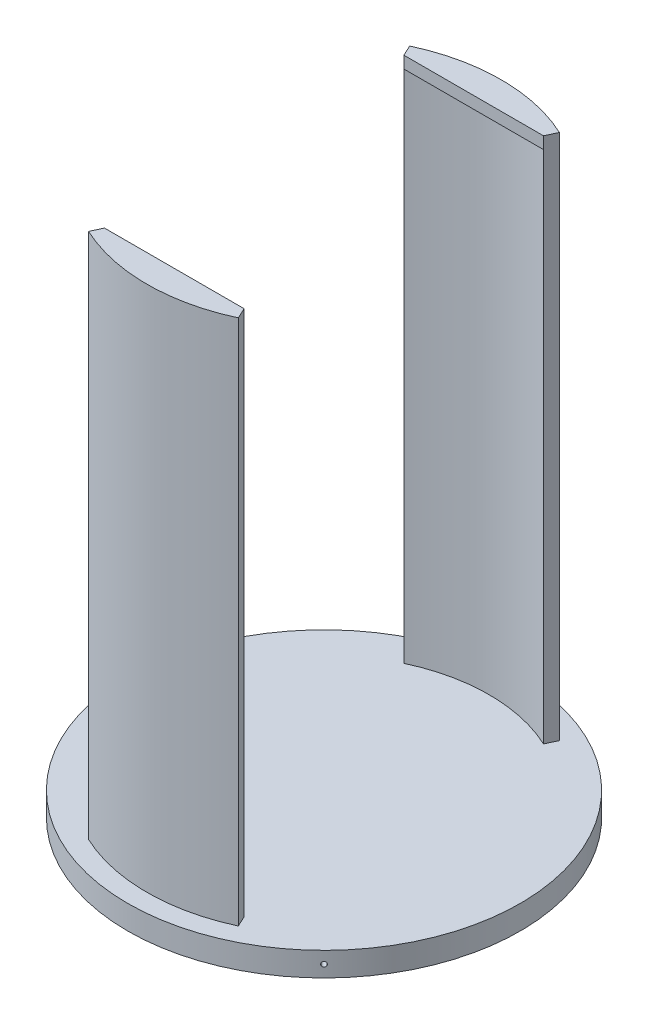
from build123d import *

# Parameters (mm, degrees)
SKETCH1_R           = 82
BOSS_EXTRUDE1_DEPTH = 10
BOSS_EXTRUDE4_DEPTH = 220
BOSS_EXTRUDE5_START = -5
BOSS_EXTRUDE5_DEPTH = 5
SKETCH7_R           = 1
CUT_EXTRUDE1_DEPTH  = 12
CIRPATTERN1_COUNT   = 4


with BuildPart() as part:
    # Sketch1 → Boss-Extrude1 (new body)
    with BuildSketch(Plane(origin=(0, 0, 0), x_dir=(1, 0, 0), z_dir=(0, 1, 0))):
        with Locations(Location((0, 0, 0), (0, 0, 270))):
            Circle(SKETCH1_R)
    extrude(amount=BOSS_EXTRUDE1_DEPTH)

    # Sketch2 → Boss-Extrude4 (add)
    with BuildSketch(Plane(origin=(0, 10, 0), x_dir=(1, 0, 0), z_dir=(0, 1, 0))):
        with BuildLine():
            Line((-29.16066006, 62.535237306), (-31.273751369, 67.066776241))
            ThreePointArc((-31.273751369, 67.066776241), (0, 74), (31.273751369, 67.066776241))
            Line((31.273751369, 67.066776241), (29.16066006, 62.535237306))
            ThreePointArc((29.16066006, 62.535237306), (0, 69), (-29.16066006, 62.535237306))
        make_face()
    boss_extrude4 = extrude(amount=BOSS_EXTRUDE4_DEPTH)

    # Mirror2: Boss-Extrude4 across plane
    add(boss_extrude4.mirror(Plane.XY))

    # Sketch4 → Boss-Extrude5 (add)
    with BuildSketch(Plane(origin=(0, 230, 0), x_dir=(1, 0, 0), z_dir=(0, 1, 0)).offset(BOSS_EXTRUDE5_START)):
        with BuildLine():
            Line((-29.16066006, 62.535237306), (29.16066006, 62.535237306))
            ThreePointArc((29.16066006, 62.535237306), (0, 69), (-29.16066006, 62.535237306))
        make_face()
    boss_extrude5 = extrude(amount=BOSS_EXTRUDE5_DEPTH)

    # Mirror3: Boss-Extrude5 across plane
    add(boss_extrude5.mirror(Plane.XY))

    # Sketch7 → Cut-Extrude1 (cut)
    with BuildSketch(Plane(origin=(-57.982756057, 0, 57.982756057), x_dir=(0.7071067811865477, 0, 0.7071067811865475), z_dir=(-0.7071067811865475, 0, 0.7071067811865477))):
        with Locations((0, 5)):
            Circle(SKETCH7_R)
    cut_extrude1 = extrude(amount=-CUT_EXTRUDE1_DEPTH, mode=Mode.SUBTRACT)

    # CirPattern1: Cut-Extrude1 ×4 about axis
    cirpattern1_axis = Axis((0, 0, 0), (0, 1, 0))
    for i in range(1, CIRPATTERN1_COUNT):
        add(cut_extrude1.rotate(cirpattern1_axis, i * 360 / CIRPATTERN1_COUNT), mode=Mode.SUBTRACT)


solid = part.part
